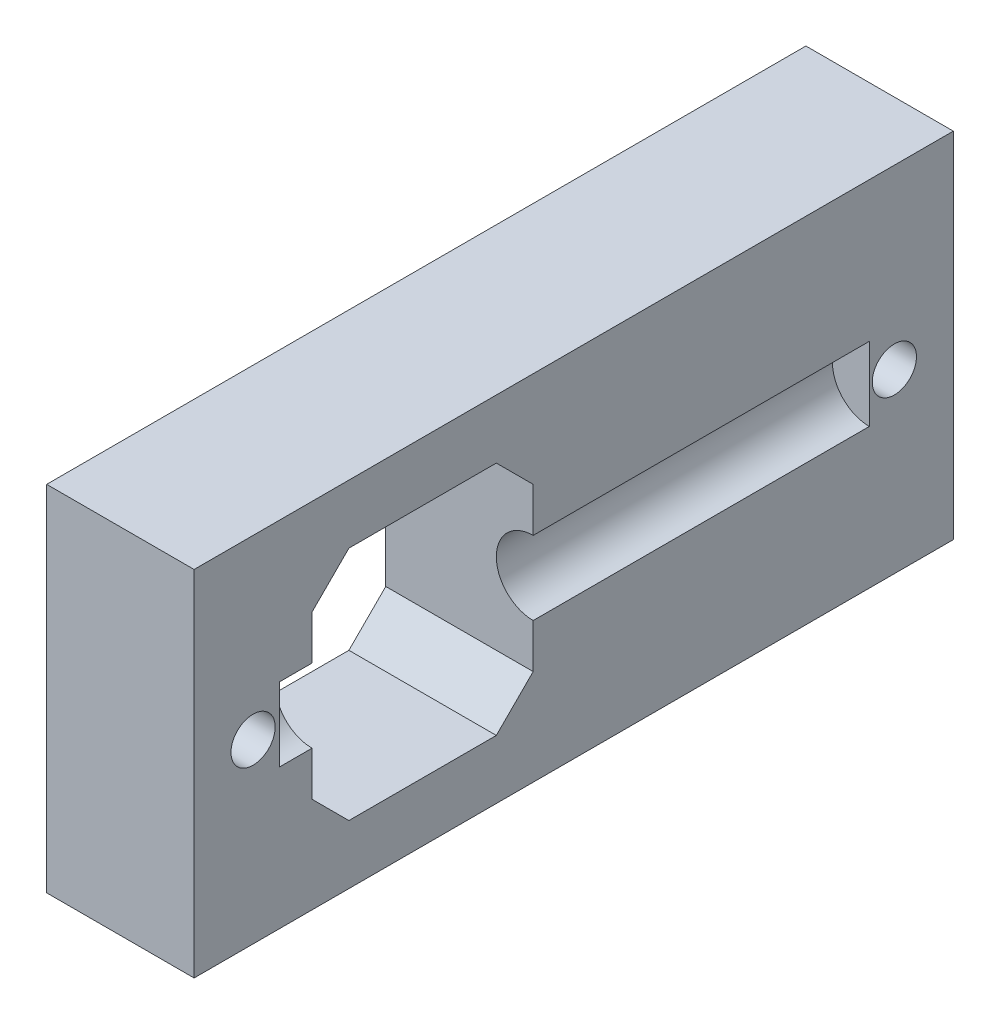
from build123d import *

# Parameters (mm, degrees)
SKETCH_1_W          = 42
SKETCH_1_H          = 42
EXTRUDE_1_DEPTH     = 40
CHAMFER_1_SIZE      = 5
SKETCH_4_R          = 1.75
CUT_EXTRUDE_1_DEPTH = 3
SKETCH_5_W          = 26
SKETCH_5_H          = 24
SKETCH_5_W_2        = 15
SKETCH_5_H_2        = 16
EXTRUDE_2_DEPTH     = 21
SKETCH_7_W          = 40
SKETCH_7_H          = 24
CUT_EXTRUDE_3_DEPTH = 21
SKETCH_6_R          = 3
CUT_EXTRUDE_2_DEPTH = 10
CHAMFER_2_SIZE      = 2.5
SKETCH_8_W          = 51.5
SKETCH_8_H          = 24
SKETCH_8_R          = 1.5
EXTRUDE_3_DEPTH     = 10
CUT_EXTRUDE_5_DEPTH = 73.374028491
CUT_EXTRUDE_START   = -5.8
SKETCH_10_R         = 2.5
CUT_EXTRUDE_6_DEPTH = 40


with BuildPart() as part:
    # 草圖1 → 填料-伸長1 (new body)
    with BuildSketch(Plane.XY):
        Rectangle(SKETCH_1_W, SKETCH_1_H)
    extrude(amount=EXTRUDE_1_DEPTH)

    # 導角1
    chamfer_1_edges = [part.edges().sort_by_distance(p)[0] for p in [
        (-21, 21, 20),
        (21, 21, 20),
        (21, -21, 20),
        (-21, -21, 20),
    ]]
    chamfer(chamfer_1_edges, length=CHAMFER_1_SIZE)

    # 草圖4 → 除料-伸長1 (cut)
    with BuildSketch(Plane.XY.offset(40)):
        with Locations((-15.5, 15.5)):
            Circle(SKETCH_4_R)
        with Locations(Location((-15.5, -15.5, 0), (0, 0, 180))):
            Circle(SKETCH_4_R)
        with Locations((15.5, -15.5)):
            Circle(SKETCH_4_R)
        with Locations(Location((15.5, 15.5, 0), (0, 0, 180))):
            Circle(SKETCH_4_R)
    extrude(amount=-CUT_EXTRUDE_1_DEPTH, mode=Mode.SUBTRACT)

    # 草圖7 → 除料-伸長3 (cut)
    with BuildSketch(Plane(origin=(21, 0, 0), x_dir=(0, 0, -1), z_dir=(1, 0, 0))):
        with Locations((-20, 0)):
            Rectangle(SKETCH_7_W, SKETCH_7_H)
    extrude(amount=-CUT_EXTRUDE_3_DEPTH, mode=Mode.SUBTRACT)


with BuildPart() as body_2:
    # 草圖5 → 填料-伸長2 (new body)
    with BuildSketch(Plane.ZY.offset(21)):
        with Locations((53, 0)):
            Rectangle(SKETCH_5_W, SKETCH_5_H)
        with Locations((50.5, 0)):
            Rectangle(SKETCH_5_W_2, SKETCH_5_H_2, mode=Mode.SUBTRACT)
    extrude(amount=-EXTRUDE_2_DEPTH)


with BuildPart() as cut_extrude_2_tool:
    # 草圖6 → 除料-伸長2 (new body)
    with BuildSketch(Plane(origin=(0, 0, 0), x_dir=(0, 0, -1), z_dir=(1, 0, 0))):
        with Locations((-62, 0)):
            Circle(SKETCH_6_R)
        with Locations((-18.5, 0)):
            Circle(SKETCH_6_R)
    extrude(amount=-CUT_EXTRUDE_2_DEPTH)


with BuildPart() as part_1:
    add(part.part)

    # 除料-伸長2: cut by cut_extrude_2_tool
    add(cut_extrude_2_tool.part, mode=Mode.SUBTRACT)



with BuildPart() as body_2_1:
    add(body_2.part)

    # 除料-伸長2: cut by cut_extrude_2_tool
    add(cut_extrude_2_tool.part, mode=Mode.SUBTRACT)

    # 導角2
    chamfer_2_edges = [body_2_1.edges().sort_by_distance(p)[0] for p in [
        (-10.5, -8, 43),
        (-10.5, 8, 43),
        (-10.5, 8, 58),
        (-10.5, -8, 58),
    ]]
    chamfer(chamfer_2_edges, length=CHAMFER_2_SIZE)


with BuildPart() as part_2:
    add(part_1.part)

    add(body_2_1.part)  # 填料-伸長3 merges body 2
    # 草圖8 → 填料-伸長3 (add)
    with BuildSketch(Plane(origin=(0, 0, 0), x_dir=(0, 0, -1), z_dir=(1, 0, 0))):
        with Locations((-40.25, 0)):
            Rectangle(SKETCH_8_W, SKETCH_8_H)
        with Locations((-62, 0)):
            Circle(SKETCH_8_R, mode=Mode.SUBTRACT)
        with Locations((-18.5, 0)):
            Circle(SKETCH_8_R, mode=Mode.SUBTRACT)
        Polygon((-58, 5.5), (-58, -5.5), (-55.5, -8), (-45.5, -8), (-43, -5.5), (-43, 5.5), (-45.5, 8), (-55.5, 8), align=None, mode=Mode.SUBTRACT)
    extrude(amount=EXTRUDE_3_DEPTH)

    # 草圖9 → 除料-伸長5 (cut, through all)
    with BuildSketch(Plane.XY.offset(66)):
        Polygon((21, 12), (21, 16), (16, 21), (-16, 21), (-21, 16), (-21, -16), (-16, -21), (16, -21), (21, -16), (21, -12), (0, -12), (0, 12), align=None)
    extrude(amount=-CUT_EXTRUDE_5_DEPTH, mode=Mode.SUBTRACT)

    # 草圖10 → 除料-伸長6 (cut)
    with BuildSketch(Plane.XY.offset(66).offset(CUT_EXTRUDE_START)):
        with Locations((10, 0)):
            Circle(SKETCH_10_R)
    extrude(amount=-CUT_EXTRUDE_6_DEPTH, mode=Mode.SUBTRACT)


solid = part_2.part
